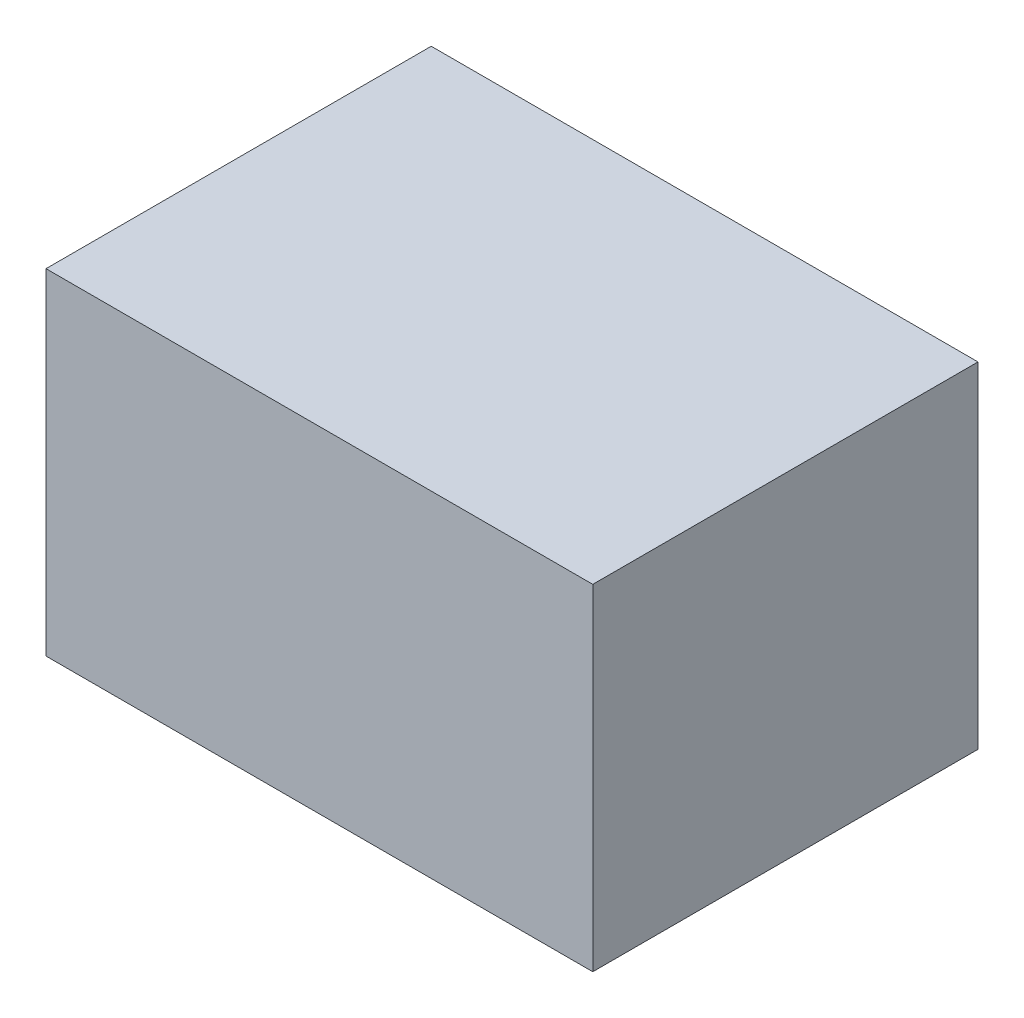
from build123d import *

# Parameters (mm, degrees)
SKETCH1_W      = 22
SKETCH1_H      = 13.5
ENVELOPE_DEPTH = 15.5


with BuildPart() as part:
    # Sketch1 → Envelope (new body)
    with BuildSketch(Plane.XY):
        Rectangle(SKETCH1_W, SKETCH1_H)
    extrude(amount=ENVELOPE_DEPTH)


solid = part.part
